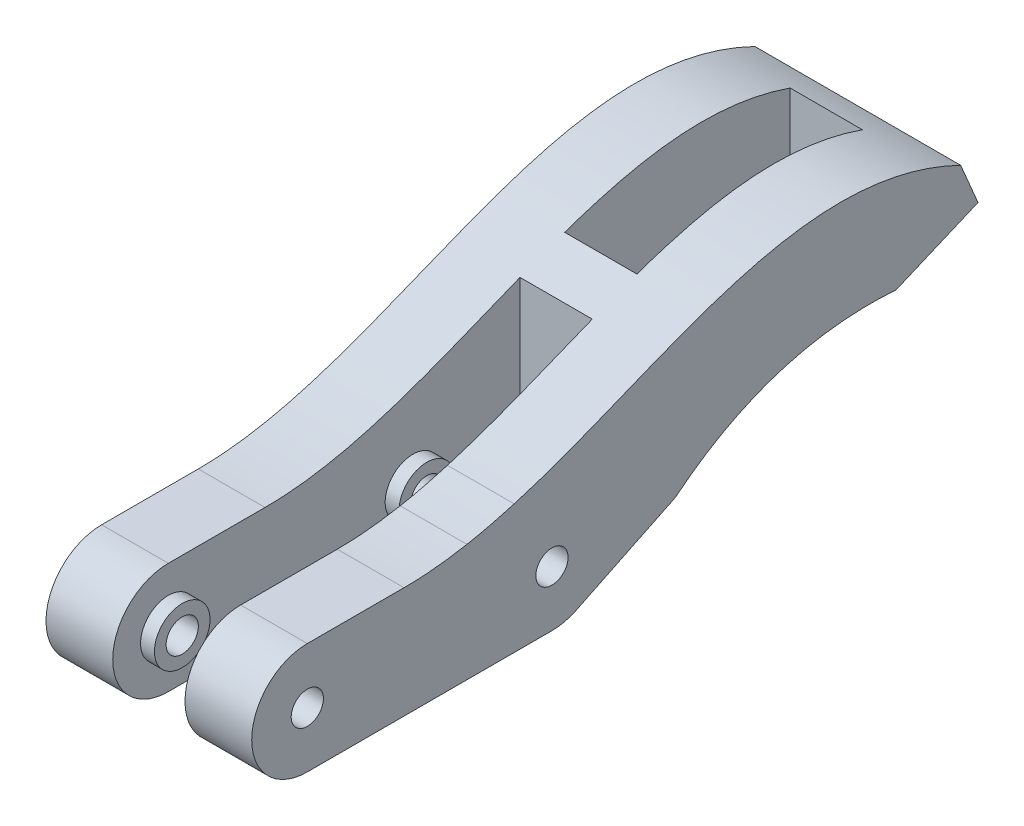
from build123d import *

# Parameters (mm, degrees)
SKETCH1_R            = 1.45
BOSS_EXTRUDE1_DEPTH  = 8.5
BOSS_EXTRUDE2_START  = -8.5
BOSS_EXTRUDE2_DEPTH  = 8.5
BOSS_EXTRUDE3_DEPTH  = 10
SKETCH4_R            = 5
BOSS_EXTRUDE4_DEPTH  = 10
BOSS_EXTRUDE5_DEPTH  = 10
BOSS_EXTRUDE6_DEPTH  = 10
BOSS_EXTRUDE7_DEPTH  = 10
BOSS_EXTRUDE8_DEPTH  = 10
BOSS_EXTRUDE9_DEPTH  = 10
SKETCH10_R           = 1.45
CUT_EXTRUDE2_DEPTH   = 28
SKETCH11_W           = 6.5
SKETCH11_H           = 22.932404029
SKETCH11_H_2         = 5
SKETCH11_H_3         = 8.694974759
CUT_EXTRUDE3_DEPTH   = 49
SKETCH12_W           = 6.5
SKETCH12_H           = 22.932404029
CUT_EXTRUDE4_DEPTH   = 49
SKETCH14_W           = 6.5
SKETCH14_H           = 20.273775142
CUT_EXTRUDE5_DEPTH   = 49
BOSS_EXTRUDE10_START = 1.25
SKETCH17_R           = 2.5
SKETCH17_R_2         = 1.45
BOSS_EXTRUDE10_DEPTH = 1.25
SKETCH18_R           = 2.5
SKETCH18_R_2         = 1.45
BOSS_EXTRUDE11_DEPTH = 1.25
SKETCH19_R           = 2.5
BOSS_EXTRUDE12_DEPTH = 1.25
BOSS_EXTRUDE13_START = 1.25
SKETCH21_R           = 2.5
SKETCH21_R_2         = 1.45
BOSS_EXTRUDE13_DEPTH = 1.25
SKETCH22_R           = 1.45
CUT_EXTRUDE6_DEPTH   = 70.556228756


with BuildPart() as part:
    # Sketch1 → Boss-Extrude1 (new body)
    with BuildSketch(Plane(origin=(0, 0, 0), x_dir=(0, 0, -1), z_dir=(1, 0, 0))):
        with BuildLine():
            Line((27, 10), (5, 10))
            ThreePointArc((5, 10), (0, 5), (5, 0))
            Line((5, 0), (27, 0))
            ThreePointArc((27, 0), (32, 5), (27, 10))
        make_face()
        with Locations((5, 5)):
            Circle(SKETCH1_R, mode=Mode.SUBTRACT)
        with Locations((27, 5)):
            Circle(SKETCH1_R, mode=Mode.SUBTRACT)
    extrude(amount=BOSS_EXTRUDE1_DEPTH)

    # Sketch2 → Boss-Extrude2 (add)
    with BuildSketch(Plane(origin=(8.5, 0, 0), x_dir=(0, 0, -1), z_dir=(1, 0, 0)).offset(BOSS_EXTRUDE2_START)):
        with BuildLine():
            add(Edge.make_bspline(
                [(63.752972286, 17.872423117), (45.928882678, 26.563787963), (31.059268621, 10), (13.694974759, 10)],
                knots=[0, 0, 0, 0, 1, 1, 1, 1], degree=3))
            Line((13.694974759, 10), (27, 10))
            ThreePointArc((27, 10), (31.87285141, 6.120410255), (29.183837075, 0.502127655))
            Line((29.183837075, 0.502127655), (38.08542066, 4.824084077))
            add(Edge.make_bspline(
                [(38.08542066, 4.824084077), (46.797509509, 11.895222457), (57.948000409, 11.067843667)],
                knots=[0, 0, 0, 1, 1, 1], degree=2))
            Line((57.948000409, 11.067843667), (65.313809691, 14.189518476))
            Line((65.313809691, 14.189518476), (63.752972286, 17.872423117))
        make_face()
    extrude(amount=BOSS_EXTRUDE2_DEPTH)

    # Sketch3 → Boss-Extrude3 (add)
    with BuildSketch(Plane(origin=(8.5, 0, 0), x_dir=(0, 0, -1), z_dir=(1, 0, 0))):
        with BuildLine():
            Line((36.108074214, 3.8640296), (33.121739514, 15.047376099))
            add(Edge.make_bspline(
                [(63.752972286, 17.872423117), (52.853080786, 23.187417369), (43.058056373, 19.057897142), (33.121739514, 15.047376099)],
                knots=[0, 0, 0, 0, 0.611525847, 0.611525847, 0.611525847, 0.611525847], degree=3))
            Line((63.752972286, 17.872423117), (65.313809691, 14.189518476))
            Line((65.313809691, 14.189518476), (57.948000409, 11.067843667))
            add(Edge.make_bspline(
                [(38.08542066, 4.824084077), (46.79750951, 11.895222457), (57.948000409, 11.067843667)],
                knots=[0, 0, 0, 1, 1, 1], degree=2))
            Line((38.08542066, 4.824084077), (36.108074214, 3.8640296))
        make_face()
    extrude(amount=BOSS_EXTRUDE3_DEPTH)

    # Sketch4 → Boss-Extrude4 (add)
    with BuildSketch(Plane(origin=(8.5, 0, 0), x_dir=(0, 0, -1), z_dir=(1, 0, 0))):
        with Locations(Location((5, 5, 0), (0, 0, 270))):
            Circle(SKETCH4_R)
    extrude(amount=BOSS_EXTRUDE4_DEPTH)

    # Sketch5 → Boss-Extrude5 (add)
    with BuildSketch(Plane(origin=(8.5, 0, 0), x_dir=(0, 0, -1), z_dir=(1, 0, 0))):
        with BuildLine():
            Line((5, 10), (13.694974759, 10))
            Line((13.694974759, 10), (13.694974759, 0))
            Line((13.694974759, 0), (5, 0))
            ThreePointArc((5, 0), (10, 5), (5, 10))
        make_face()
    extrude(amount=BOSS_EXTRUDE5_DEPTH)

    # Sketch6 → Boss-Extrude6 (add)
    with BuildSketch(Plane(origin=(8.5, 0, 0), x_dir=(0, 0, -1), z_dir=(1, 0, 0))):
        with BuildLine():
            Line((19.355254229, 10.548091727), (21.320062705, 0))
            Line((21.320062705, 0), (13.694974759, 0))
            Line((13.694974759, 0), (13.694974759, 10))
            add(Edge.make_bspline(
                [(19.355254229, 10.548091727), (17.493954956, 10.201384788), (15.609630186, 10), (13.694974759, 10)],
                knots=[0.889736062, 0.889736062, 0.889736062, 0.889736062, 1, 1, 1, 1], degree=3))
        make_face()
    extrude(amount=BOSS_EXTRUDE6_DEPTH)

    # Sketch7 → Boss-Extrude7 (add)
    with BuildSketch(Plane(origin=(8.5, 0, 0), x_dir=(0, 0, -1), z_dir=(1, 0, 0))):
        with BuildLine():
            Line((32.645955645, 2.183078628), (28.509427835, 13.235241807))
            add(Edge.make_bspline(
                [(33.121739514, 15.047376099), (31.589187648, 14.428803684), (30.053274551, 13.813062163), (28.509427835, 13.235241807)],
                knots=[0.611525847, 0.611525847, 0.611525847, 0.611525847, 0.705846016, 0.705846016, 0.705846016, 0.705846016], degree=3))
            Line((33.121739514, 15.047376099), (36.108074214, 3.8640296))
            Line((36.108074214, 3.8640296), (32.645955645, 2.183078628))
        make_face()
    extrude(amount=BOSS_EXTRUDE7_DEPTH)

    # Sketch8 → Boss-Extrude8 (add)
    with BuildSketch(Plane(origin=(8.5, 0, 0), x_dir=(0, 0, -1), z_dir=(1, 0, 0))):
        with BuildLine():
            Line((27, 0), (23.604335966, 11.578089924))
            add(Edge.make_bspline(
                [(28.509427835, 13.235241807), (26.884956708, 12.627245898), (25.251701682, 12.061235292), (23.604335966, 11.578089924)],
                knots=[0.705846016, 0.705846016, 0.705846016, 0.705846016, 0.805091873, 0.805091873, 0.805091873, 0.805091873], degree=3))
            Line((28.509427835, 13.235241807), (32.645955645, 2.183078628))
            Line((32.645955645, 2.183078628), (29.183837075, 0.502127655))
            ThreePointArc((29.183837075, 0.502127655), (28.120410255, 0.12714859), (27, 0))
        make_face()
    extrude(amount=BOSS_EXTRUDE8_DEPTH)

    # Sketch9 → Boss-Extrude9 (add)
    with BuildSketch(Plane(origin=(8.5, 0, 0), x_dir=(0, 0, -1), z_dir=(1, 0, 0))):
        with BuildLine():
            Line((23.604335966, 11.578089924), (27, 0))
            Line((27, 0), (21.320062705, 0))
            Line((21.320062705, 0), (19.355254229, 10.548091727))
            add(Edge.make_bspline(
                [(19.355254229, 10.548091727), (20.788925962, 10.815127802), (22.205425846, 11.167809658), (23.604335966, 11.578089924)],
                knots=[0, 0, 0, 0, 1, 1, 1, 1], degree=3))
        make_face()
    extrude(amount=BOSS_EXTRUDE9_DEPTH)

    # Sketch10 → Cut-Extrude2 (cut)
    with BuildSketch(Plane.ZY):
        with Locations(Location((-27, 5, 0), (0, 0, 180))):
            Circle(SKETCH10_R)
        with Locations(Location((-5, 5, 0), (0, 0, 180))):
            Circle(SKETCH10_R)
    extrude(amount=-CUT_EXTRUDE2_DEPTH, mode=Mode.SUBTRACT)

    # Sketch11 → Cut-Extrude3 (cut)
    with BuildSketch(Plane(origin=(0, 10, 0), x_dir=(1, 0, 0), z_dir=(0, 1, 0))):
        with Locations((9.25, 25.161176774)):
            Rectangle(SKETCH11_W, SKETCH11_H)
        with Locations((9.25, 2.5)):
            Rectangle(SKETCH11_W, SKETCH11_H_2)
        with Locations((9.25, 9.34748738)):
            Rectangle(SKETCH11_W, SKETCH11_H_3)
    extrude(amount=-CUT_EXTRUDE3_DEPTH, mode=Mode.SUBTRACT)

    # Sketch12 → Cut-Extrude4 (cut)
    with BuildSketch(Plane(origin=(0, 10, 0), x_dir=(-1, 0, 0), z_dir=(0, -1, 0))):
        with Locations((-9.25, 25.161176774)):
            Rectangle(SKETCH12_W, SKETCH12_H)
    extrude(amount=-CUT_EXTRUDE4_DEPTH, mode=Mode.SUBTRACT)

    # Sketch14 → Cut-Extrude5 (cut)
    with BuildSketch(Plane.XZ):
        with Locations((9.25, -50.780431109)):
            Rectangle(SKETCH14_W, SKETCH14_H)
    extrude(amount=-CUT_EXTRUDE5_DEPTH, mode=Mode.SUBTRACT)

    # Sketch17 → Boss-Extrude10 (add)
    with BuildSketch(Plane.ZY.offset(-12.5).offset(BOSS_EXTRUDE10_START)):
        with Locations(Location((-5, 5, 0), (0, 0, 180))):
            Circle(SKETCH17_R)
        with Locations(Location((-5, 5, 0), (0, 0, 180))):
            Circle(SKETCH17_R_2, mode=Mode.SUBTRACT)
    extrude(amount=-BOSS_EXTRUDE10_DEPTH)

    # Sketch18 → Boss-Extrude11 (add)
    with BuildSketch(Plane(origin=(6, 0, 0), x_dir=(0, 0, -1), z_dir=(1, 0, 0))):
        with Locations((5, 5)):
            Circle(SKETCH18_R)
        with Locations((5, 5)):
            Circle(SKETCH18_R_2, mode=Mode.SUBTRACT)
    extrude(amount=BOSS_EXTRUDE11_DEPTH)

    # Sketch19 → Boss-Extrude12 (add)
    with BuildSketch(Plane(origin=(6, 0, 0), x_dir=(0, 0, -1), z_dir=(1, 0, 0))):
        with Locations((27, 5)):
            Circle(SKETCH19_R)
    extrude(amount=BOSS_EXTRUDE12_DEPTH)

    # Sketch21 → Boss-Extrude13 (add)
    with BuildSketch(Plane.ZY.offset(-12.5).offset(BOSS_EXTRUDE13_START)):
        with Locations(Location((-27, 5, 0), (0, 0, 180))):
            Circle(SKETCH21_R)
        with Locations(Location((-27, 5, 0), (0, 0, 180))):
            Circle(SKETCH21_R_2, mode=Mode.SUBTRACT)
    extrude(amount=-BOSS_EXTRUDE13_DEPTH)

    # Sketch22 → Cut-Extrude6 (cut, through all)
    with BuildSketch(Plane.ZY.offset(-12.5)):
        with Locations(Location((-27, 5, 0), (0, 0, 180))):
            Circle(SKETCH22_R)
    extrude(amount=CUT_EXTRUDE6_DEPTH, mode=Mode.SUBTRACT)


solid = part.part
